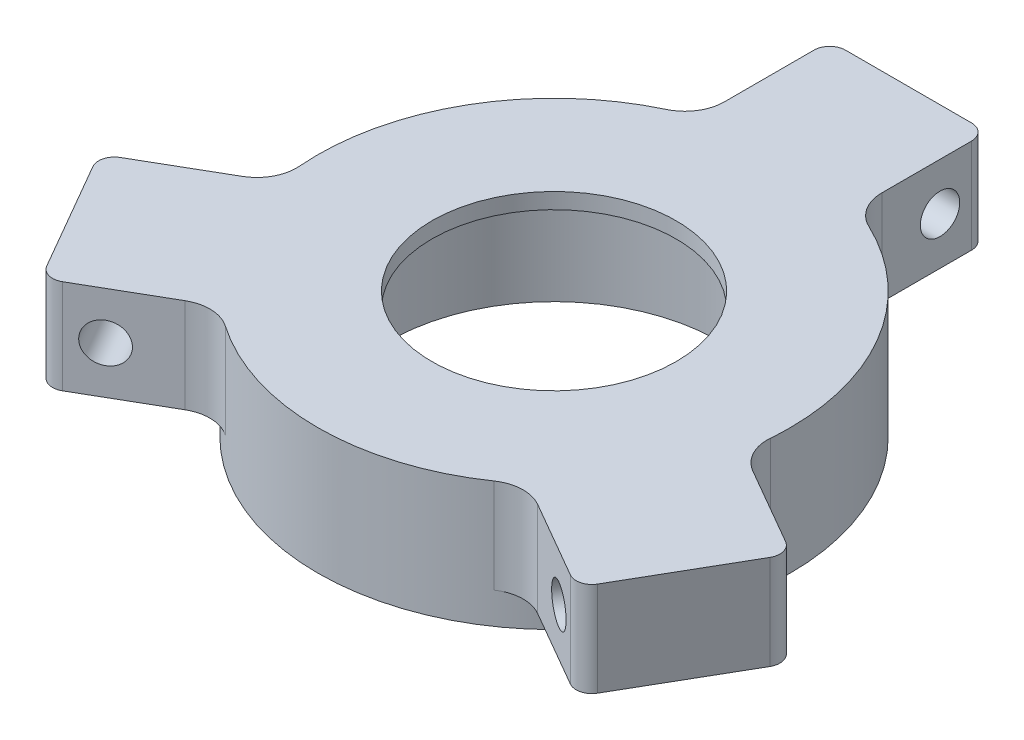
from build123d import *

# Parameters (mm, degrees)
EXTRUDE_START                = -12
EXTRUDE_1_DEPTH              = 12
HOLE_WIZARD_M5_1_D           = 4.2
HOLE_WIZARD_M5_1_DEPTH       = 12.4
HOLE_WIZARD_M5_1_CBORE_D     = 5
HOLE_WIZARD_M5_1_CBORE_DEPTH = 10
HOLE_WIZARD_M5_1_TIP         = 1.2618073
HOLE_WIZARD_M5_2_D           = 4.2
HOLE_WIZARD_M5_2_DEPTH       = 12.4
HOLE_WIZARD_M5_2_CBORE_D     = 5
HOLE_WIZARD_M5_2_CBORE_DEPTH = 10
HOLE_WIZARD_M5_2_TIP         = 1.2618073
HOLE_WIZARD_M5_3_D           = 4.2
HOLE_WIZARD_M5_3_DEPTH       = 12.4
HOLE_WIZARD_M5_3_CBORE_D     = 5
HOLE_WIZARD_M5_3_CBORE_DEPTH = 10
HOLE_WIZARD_M5_3_TIP         = 1.2618073
HOLE_WIZARD_M5_4_D           = 4.2
HOLE_WIZARD_M5_4_DEPTH       = 12.4
HOLE_WIZARD_M5_4_CBORE_D     = 5
HOLE_WIZARD_M5_4_CBORE_DEPTH = 10
HOLE_WIZARD_M5_4_TIP         = 1.2618073
HOLE_WIZARD_M5_5_D           = 4.2
HOLE_WIZARD_M5_5_DEPTH       = 12.4
HOLE_WIZARD_M5_5_CBORE_D     = 5
HOLE_WIZARD_M5_5_CBORE_DEPTH = 10
HOLE_WIZARD_M5_5_TIP         = 1.2618073
HOLE_WIZARD_M5_6_D           = 4.2
HOLE_WIZARD_M5_6_DEPTH       = 12.4
HOLE_WIZARD_M5_6_CBORE_D     = 5
HOLE_WIZARD_M5_6_CBORE_DEPTH = 10
HOLE_WIZARD_M5_6_TIP         = 1.2618073
SKETCH_12_R                  = 15.5
CUT_EXTRUDE_1_DEPTH          = 72.996259845
CHAMFER_3_SIZE               = 2
SKETCH_19_R                  = 39.897088004
CUT_EXTRUDE_2_DEPTH          = 15
SKETCH_20_R                  = 21
CUT_EXTRUDE_3_DEPTH          = 16
SKETCH_22_R                  = 19
CUT_EXTRUDE_5_DEPTH          = 2
SKETCH_23_R                  = 30
CUT_EXTRUDE_6_DEPTH          = 4
HOLE_WIZARD_M4_1_D           = 3.3
HOLE_WIZARD_M4_1_DEPTH       = 10.1
HOLE_WIZARD_M4_1_CBORE_D     = 4
HOLE_WIZARD_M4_1_CBORE_DEPTH = 8
HOLE_WIZARD_M4_1_TIP         = 0.991420021
FILLET_1_R                   = 5
FILLET_2_R                   = 2


with BuildPart() as part:
    # 草图1 → 旋转1 (revolve)
    with BuildSketch(Plane.XY, mode=Mode.PRIVATE) as revolve_1_sk:
        Polygon((0, 31.73223769), (-30, 31.73223769), (-30, 11.73223769), (-30, -3.26776231), (-15, -3.26776231), (0, -3.26776231), align=None)
    revolve(revolve_1_sk.sketch.rotate(Axis((0, -1000, 0), (0, 1, 0)), 180), axis=Axis((0, -1000, 0), (0, 1, 0)))

    # 草图2 → 拉伸1 (add)
    with BuildSketch(Plane(origin=(0, 31.73223769, 0), x_dir=(-1, 0, 0), z_dir=(0, 1, 0)).offset(EXTRUDE_START)):
        with BuildLine():
            Line((-33.97114317, 31.160254038), (-19.494897428, 22.802389662))
            ThreePointArc((-19.494897428, 22.802389662), (-25.980762114, 15), (-29.494897428, 5.481881586))
            Line((-29.494897428, 5.481881586), (-43.97114317, 13.839745962))
            Line((-43.97114317, 13.839745962), (-33.97114317, 31.160254038))
        make_face()
        with BuildLine():
            Line((33.97114317, 31.160254038), (43.97114317, 13.839745962))
            Line((43.97114317, 13.839745962), (29.494897428, 5.481881586))
            ThreePointArc((29.494897428, 5.481881586), (25.980762114, 15), (19.494897428, 22.802389662))
            Line((19.494897428, 22.802389662), (33.97114317, 31.160254038))
        make_face()
        with BuildLine():
            Line((10, -28.284271247), (10, -45))
            Line((10, -45), (-10, -45))
            Line((-10, -45), (-10, -28.284271247))
            ThreePointArc((-10, -28.284271247), (0, -30), (10, -28.284271247))
        make_face()
    extrude(amount=EXTRUDE_1_DEPTH)

    # M5 螺纹孔1
    with Locations(Plane(origin=(10, 25.73223769, -39), x_dir=(0, 1, 0), z_dir=(1, 0, 0))):
        with Locations((0, 0)):
            CounterBoreHole(HOLE_WIZARD_M5_1_D / 2, HOLE_WIZARD_M5_1_CBORE_D / 2, HOLE_WIZARD_M5_1_CBORE_DEPTH, depth=HOLE_WIZARD_M5_1_DEPTH)
            with Locations((0, 0, -(HOLE_WIZARD_M5_1_DEPTH + HOLE_WIZARD_M5_1_TIP / 2))):  # 118° drill point
                Cone(0, HOLE_WIZARD_M5_1_D / 2, HOLE_WIZARD_M5_1_TIP, mode=Mode.SUBTRACT)

    # M5 螺纹孔2
    with Locations(Plane.ZY.offset(10)):
        with Locations((-39, 25.73223769)):
            CounterBoreHole(HOLE_WIZARD_M5_2_D / 2, HOLE_WIZARD_M5_2_CBORE_D / 2, HOLE_WIZARD_M5_2_CBORE_DEPTH, depth=HOLE_WIZARD_M5_2_DEPTH)
            with Locations((0, 0, -(HOLE_WIZARD_M5_2_DEPTH + HOLE_WIZARD_M5_2_TIP / 2))):  # 118° drill point
                Cone(0, HOLE_WIZARD_M5_2_D / 2, HOLE_WIZARD_M5_2_TIP, mode=Mode.SUBTRACT)

    # M5 螺纹孔3
    with Locations(Plane(origin=(28.774990748, 25.73223769, 28.160254038), x_dir=(0.866025403784, 0, 0.5), z_dir=(-0.5, 0, 0.866025403784))):
        with Locations((0, 0)):
            CounterBoreHole(HOLE_WIZARD_M5_3_D / 2, HOLE_WIZARD_M5_3_CBORE_D / 2, HOLE_WIZARD_M5_3_CBORE_DEPTH, depth=HOLE_WIZARD_M5_3_DEPTH)
            with Locations((0, 0, -(HOLE_WIZARD_M5_3_DEPTH + HOLE_WIZARD_M5_3_TIP / 2))):  # 118° drill point
                Cone(0, HOLE_WIZARD_M5_3_D / 2, HOLE_WIZARD_M5_3_TIP, mode=Mode.SUBTRACT)

    # M5 螺纹孔4
    with Locations(Plane(origin=(38.774990748, 25.73223769, 10.839745962), x_dir=(-0.866025403784, 0, -0.5), z_dir=(0.5, 0, -0.866025403784))):
        with Locations((0, 0)):
            CounterBoreHole(HOLE_WIZARD_M5_4_D / 2, HOLE_WIZARD_M5_4_CBORE_D / 2, HOLE_WIZARD_M5_4_CBORE_DEPTH, depth=HOLE_WIZARD_M5_4_DEPTH)
            with Locations((0, 0, -(HOLE_WIZARD_M5_4_DEPTH + HOLE_WIZARD_M5_4_TIP / 2))):  # 118° drill point
                Cone(0, HOLE_WIZARD_M5_4_D / 2, HOLE_WIZARD_M5_4_TIP, mode=Mode.SUBTRACT)

    # M5 螺纹孔5
    with Locations(Plane(origin=(-5, 0, -8.660254038), x_dir=(-0.8660254037844396, 1.0079044292037923e-15, 0.4999999999999983), z_dir=(-0.4999999999999983, -1.7457416805546845e-15, -0.8660254037844396))):
        with Locations((39, 25.73223769)):
            CounterBoreHole(HOLE_WIZARD_M5_5_D / 2, HOLE_WIZARD_M5_5_CBORE_D / 2, HOLE_WIZARD_M5_5_CBORE_DEPTH, depth=HOLE_WIZARD_M5_5_DEPTH)
            with Locations((0, 0, -(HOLE_WIZARD_M5_5_DEPTH + HOLE_WIZARD_M5_5_TIP / 2))):  # 118° drill point
                Cone(0, HOLE_WIZARD_M5_5_D / 2, HOLE_WIZARD_M5_5_TIP, mode=Mode.SUBTRACT)

    # M5 螺纹孔6
    with Locations(Plane(origin=(-28.774990748, 25.73223769, 28.160254038), x_dir=(0.866025403784, 0, -0.5), z_dir=(0.5, 0, 0.866025403784))):
        with Locations((0, 0)):
            CounterBoreHole(HOLE_WIZARD_M5_6_D / 2, HOLE_WIZARD_M5_6_CBORE_D / 2, HOLE_WIZARD_M5_6_CBORE_DEPTH, depth=HOLE_WIZARD_M5_6_DEPTH)
            with Locations((0, 0, -(HOLE_WIZARD_M5_6_DEPTH + HOLE_WIZARD_M5_6_TIP / 2))):  # 118° drill point
                Cone(0, HOLE_WIZARD_M5_6_D / 2, HOLE_WIZARD_M5_6_TIP, mode=Mode.SUBTRACT)

    # 草图12 → 切除-拉伸1 (cut, through all)
    with BuildSketch(Plane(origin=(0, 31.73223769, 0), x_dir=(-1, 0, 0), z_dir=(0, 1, 0))):
        Circle(SKETCH_12_R)
    extrude(amount=-CUT_EXTRUDE_1_DEPTH, mode=Mode.SUBTRACT)

    # 倒角3
    chamfer_3_edges = [part.edges().sort_by_distance(p)[0] for p in [
        (-30, -3.26776231, 0),
    ]]
    chamfer(chamfer_3_edges, length=CHAMFER_3_SIZE)

    # 草图19 → 切除-拉伸2 (cut)
    with BuildSketch(Plane.XZ.offset(3.26776231)):
        Circle(SKETCH_19_R)
    extrude(amount=-CUT_EXTRUDE_2_DEPTH, mode=Mode.SUBTRACT)

    # 草图20 → 切除-拉伸3 (cut)
    with BuildSketch(Plane.XZ.offset(-11.73223769)):
        Circle(SKETCH_20_R)
    extrude(amount=-CUT_EXTRUDE_3_DEPTH, mode=Mode.SUBTRACT)

    # 草图22 → 切除-拉伸5 (cut)
    with BuildSketch(Plane.XZ.offset(-27.73223769)):
        Circle(SKETCH_22_R)
    extrude(amount=-CUT_EXTRUDE_5_DEPTH, mode=Mode.SUBTRACT)

    # 草图23 → 切除-拉伸6 (cut)
    with BuildSketch(Plane.XZ.offset(-11.73223769)):
        Circle(SKETCH_23_R)
    extrude(amount=-CUT_EXTRUDE_6_DEPTH, mode=Mode.SUBTRACT)

    # M4 螺纹孔1
    with Locations(Plane(origin=(-12.5, 15.73223769, 21.650635095), x_dir=(-1, 0, 0), z_dir=(0, -1, 0))):
        with Locations((0, 0), (-25, 0), (-37.5, 21.650635095), (-25, 43.30127019), (0, 43.30127019), (12.5, 21.650635095)):
            CounterBoreHole(HOLE_WIZARD_M4_1_D / 2, HOLE_WIZARD_M4_1_CBORE_D / 2, HOLE_WIZARD_M4_1_CBORE_DEPTH, depth=HOLE_WIZARD_M4_1_DEPTH)
            with Locations((0, 0, -(HOLE_WIZARD_M4_1_DEPTH + HOLE_WIZARD_M4_1_TIP / 2))):  # 118° drill point
                Cone(0, HOLE_WIZARD_M4_1_D / 2, HOLE_WIZARD_M4_1_TIP, mode=Mode.SUBTRACT)

    # 圆角1
    fillet_1_edges = [part.edges().sort_by_distance(p)[0] for p in [
        (19.494897428, 25.73223769, 22.802389662),
        (29.494897428, 25.73223769, 5.481881586),
        (10, 25.73223769, -28.284271247),
        (-10, 25.73223769, -28.284271247),
        (-19.494897428, 25.73223769, 22.802389662),
        (-29.494897428, 25.73223769, 5.481881586),
    ]]
    fillet(fillet_1_edges, radius=FILLET_1_R)

    # 圆角2
    fillet_2_edges = [part.edges().sort_by_distance(p)[0] for p in [
        (43.97114317, 25.73223769, 13.839745962),
        (33.97114317, 25.73223769, 31.160254038),
        (-10, 25.73223769, -45),
        (10, 25.73223769, -45),
        (-33.97114317, 25.73223769, 31.160254038),
        (-43.97114317, 25.73223769, 13.839745962),
    ]]
    fillet(fillet_2_edges, radius=FILLET_2_R)


solid = part.part
